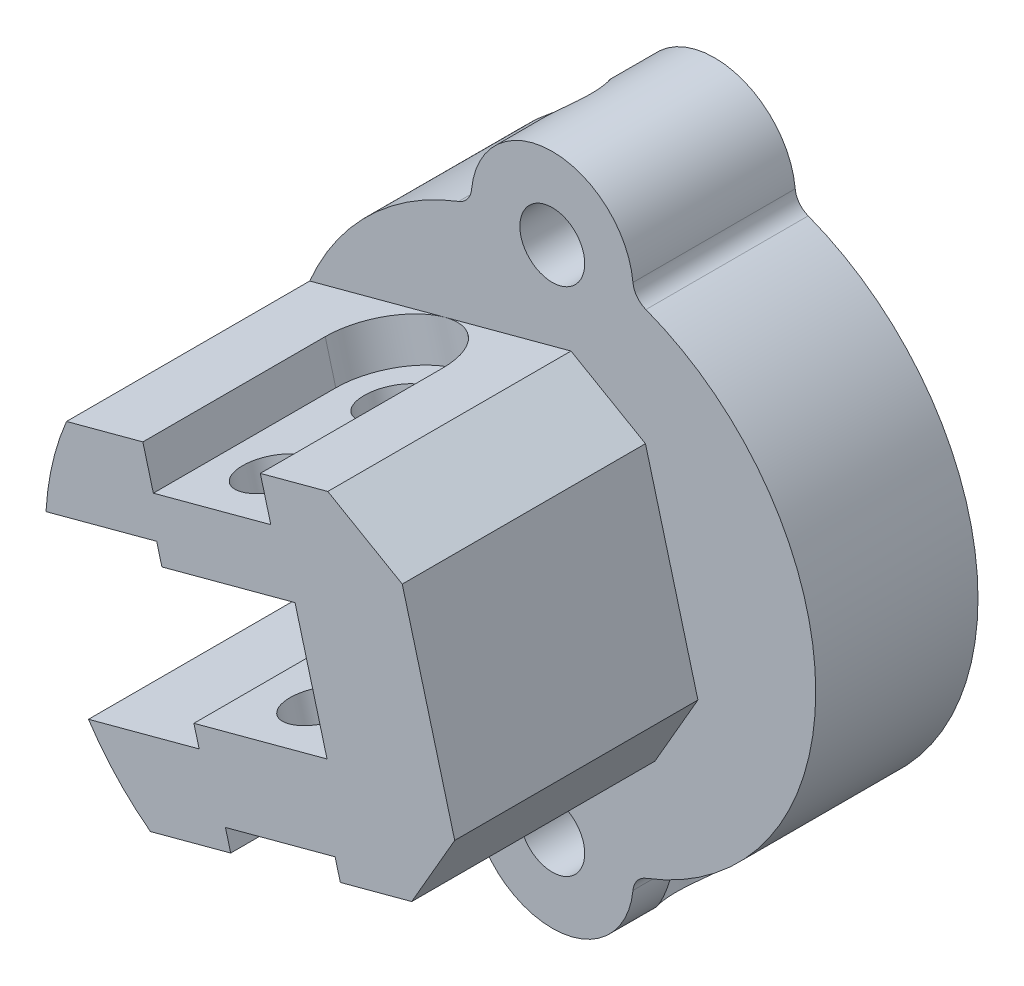
from build123d import *

# Parameters (mm, degrees)
SKETCH1_R               = 1.6
BOSS_EXTRUDE1_DEPTH     = 8.00600005
CUT_EXTRUDE1_DEPTH      = 23.553404107
CUT_EXTRUDE1_DEPTH_BACK = 23.553404107
SKETCH3_R               = 2.1
BOSS_EXTRUDE2_DEPTH     = 12
CHAMFER1_SIZE           = 3
CUT_EXTRUDE4_DEPTH      = 35.916819883
CUT_EXTRUDE4_DEPTH_BACK = 35.916819883
SKETCH7_R               = 1.55
CUT_EXTRUDE5_DEPTH      = 2
CUT_EXTRUDE5_DEPTH_BACK = 1
CUT_EXTRUDE6_DEPTH      = 2


with BuildPart() as part:
    # Sketch1 → Boss-Extrude1 (new body)
    with BuildSketch(Plane.XY):
        with BuildLine():
            ThreePointArc((4.62089851, -12.151020408), (13, 0), (4.62089851, 12.151020408))
            ThreePointArc((4.62089851, 12.151020408), (4.181690754, 12.478661471), (3.981081793, 12.988571429))
            ThreePointArc((3.981081793, 12.988571429), (0, 16.6), (-3.981081793, 12.988571429))
            ThreePointArc((-3.981081793, 12.988571429), (-4.181690754, 12.478661471), (-4.62089851, 12.151020408))
            ThreePointArc((-4.62089851, 12.151020408), (-13, 0), (-4.62089851, -12.151020408))
            ThreePointArc((-4.62089851, -12.151020408), (-4.181690754, -12.478661471), (-3.981081793, -12.988571429))
            ThreePointArc((-3.981081793, -12.988571429), (0, -16.6), (3.981081793, -12.988571429))
            ThreePointArc((3.981081793, -12.988571429), (4.181690754, -12.478661471), (4.62089851, -12.151020408))
        make_face()
        with Locations((0, 12.6)):
            Circle(SKETCH1_R, mode=Mode.SUBTRACT)
        with Locations((0, -12.6)):
            Circle(SKETCH1_R, mode=Mode.SUBTRACT)
    extrude(amount=BOSS_EXTRUDE1_DEPTH)

    # Sketch3 → Cut-Extrude1 (cut, two sides: drawn at the far end of the back side and taken through both)
    with BuildSketch(Plane(origin=(0, 0, 0), x_dir=(0, 0, 1), z_dir=(-0.25881904510252135, 0.9659258262890681, 0)).offset(-CUT_EXTRUDE1_DEPTH_BACK)):
        with Locations((4.003000025, 0)):
            Circle(SKETCH3_R)
    extrude(amount=CUT_EXTRUDE1_DEPTH + CUT_EXTRUDE1_DEPTH_BACK, mode=Mode.SUBTRACT)

    # Sketch6 → Boss-Extrude2 (add)
    with BuildSketch(Plane.XY.offset(8.00600005)):
        with BuildLine():
            Line((-7.827242025, -10.379512623), (7.962699901, -6.148610435))
            Line((7.962699901, -6.148610435), (3.82159518, 9.306202785))
            Line((3.82159518, 9.306202785), (-11.968346746, 5.075300598))
            ThreePointArc((-11.968346746, 5.075300598), (-12.66343786, 2.938935449), (-12.9803337, 0.714798598))
            Line((-12.9803337, 0.714798598), (-7.519920169, 2.177911994))
            Line((-7.519920169, 2.177911994), (-7.261101124, 1.211986168))
            Line((-7.261101124, 1.211986168), (-0.692805505, 2.971955675))
            Line((-0.692805505, 2.971955675), (0.88599067, -2.920191866))
            Line((0.88599067, -2.920191866), (-5.682304949, -4.680161372))
            Line((-5.682304949, -4.680161372), (-5.423485903, -5.646087199))
            Line((-5.423485903, -5.646087199), (-10.883899435, -7.109200595))
            ThreePointArc((-10.883899435, -7.109200595), (-9.497391161, -8.876911689), (-7.827242025, -10.379512623))
        make_face()
    extrude(amount=BOSS_EXTRUDE2_DEPTH)

    # Chamfer1
    chamfer1_edges = [part.edges().sort_by_distance(p)[0] for p in [
        (7.962699901, -6.148610435, 14.00600005),
        (3.82159518, 9.306202785, 14.00600005),
    ]]
    chamfer(chamfer1_edges, length=CHAMFER1_SIZE)

    # Sketch7 → Cut-Extrude4 (cut, two sides: drawn at the far end of the back side and taken through both)
    with BuildSketch(Plane(origin=(-2.070552361, 7.72740661, 0), x_dir=(0.9659258262890701, 0.2588190451025142, 0), z_dir=(-0.2588190451025142, 0.9659258262890701, 0)).offset(-CUT_EXTRUDE4_DEPTH_BACK)):
        with Locations((-3.346950766, -17.00600005)):
            Circle(SKETCH7_R)
        with Locations((-3.346950766, -11.00600005)):
            Circle(SKETCH7_R)
    extrude(amount=CUT_EXTRUDE4_DEPTH + CUT_EXTRUDE4_DEPTH_BACK, mode=Mode.SUBTRACT)

    # Sketch8 → Cut-Extrude5 (cut, two sides: drawn at the far end of the back side and taken through both)
    with BuildSketch(Plane(origin=(2.070552361, -7.72740661, 0), x_dir=(0.9659258262890699, 0.25881904510251513, 0), z_dir=(0.2588190451025151, -0.9659258262890698, 0)).offset(-CUT_EXTRUDE5_DEPTH_BACK)):
        Polygon((-6.146950766, 12.622580803), (-6.146950766, 20.00600005), (-0.546950766, 20.00600005), (-0.546950766, 12.622580803), (-0.546950766, 9.389419296), (-3.346950766, 7.772838542), (-6.146950766, 9.389419296), align=None)
    extrude(amount=CUT_EXTRUDE5_DEPTH + CUT_EXTRUDE5_DEPTH_BACK, mode=Mode.SUBTRACT)

    # Sketch9 → Cut-Extrude6 (cut)
    with BuildSketch(Plane(origin=(-2.070552361, 7.72740661, 0), x_dir=(0.9659258262890701, 0.2588190451025142, 0), z_dir=(-0.2588190451025142, 0.9659258262890701, 0))):
        with BuildLine():
            Line((-6.346950766, -20.00600005), (-6.346950766, -11.00600005))
            ThreePointArc((-6.346950766, -11.00600005), (-3.346950766, -8.00600005), (-0.346950766, -11.00600005))
            Line((-0.346950766, -11.00600005), (-0.346950766, -20.00600005))
            Line((-0.346950766, -20.00600005), (-6.346950766, -20.00600005))
        make_face()
    extrude(amount=-CUT_EXTRUDE6_DEPTH, mode=Mode.SUBTRACT)


solid = part.part
